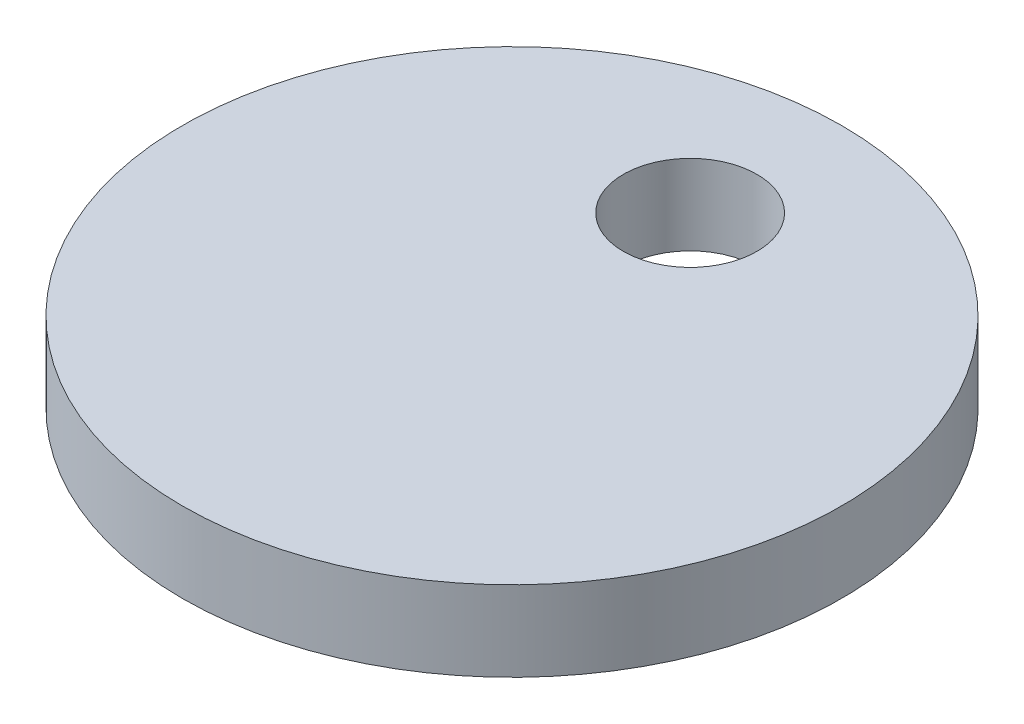
from build123d import *

# Parameters (mm, degrees)
SKETCH1_R           = 7.4
BOSS_EXTRUDE1_DEPTH = 1.8
SKETCH2_R           = 1.5
CUT_EXTRUDE1_DEPTH  = 1.8


with BuildPart() as part:
    # Sketch1 → Boss-Extrude1 (new body)
    with BuildSketch(Plane(origin=(0, 0, 0), x_dir=(1, 0, 0), z_dir=(0, 1, 0))):
        with Locations(Location((0, 0, 0), (0, 0, 270))):
            Circle(SKETCH1_R)
    extrude(amount=BOSS_EXTRUDE1_DEPTH)

    # Sketch2 → Cut-Extrude1 (cut)
    with BuildSketch(Plane(origin=(0, 1.8, 0), x_dir=(1, 0, 0), z_dir=(0, 1, 0))):
        with Locations(Location((0, 4, 0), (0, 0, 270))):
            Circle(SKETCH2_R)
    extrude(amount=-CUT_EXTRUDE1_DEPTH, mode=Mode.SUBTRACT)


solid = part.part
